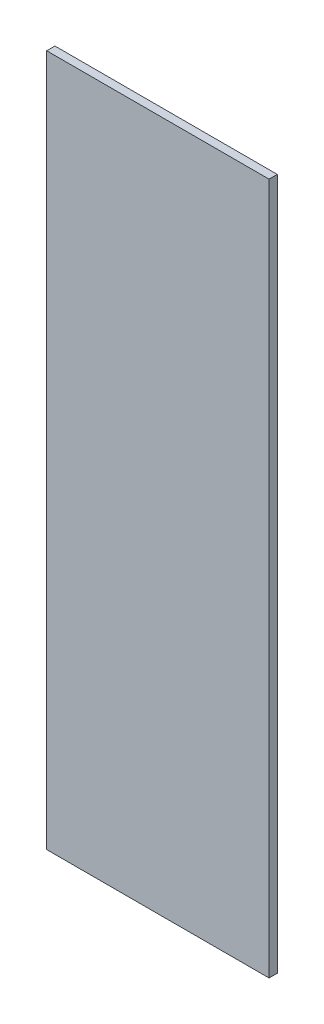
from build123d import *

# Parameters (mm, degrees)
SKETCH1_W           = 342.9
SKETCH1_H           = 1066.8
BOSS_EXTRUDE1_DEPTH = 12.7


with BuildPart() as part:
    # Sketch1 → Boss-Extrude1 (new body)
    with BuildSketch(Plane.XY):
        Rectangle(SKETCH1_W, SKETCH1_H)
    extrude(amount=BOSS_EXTRUDE1_DEPTH)


solid = part.part
